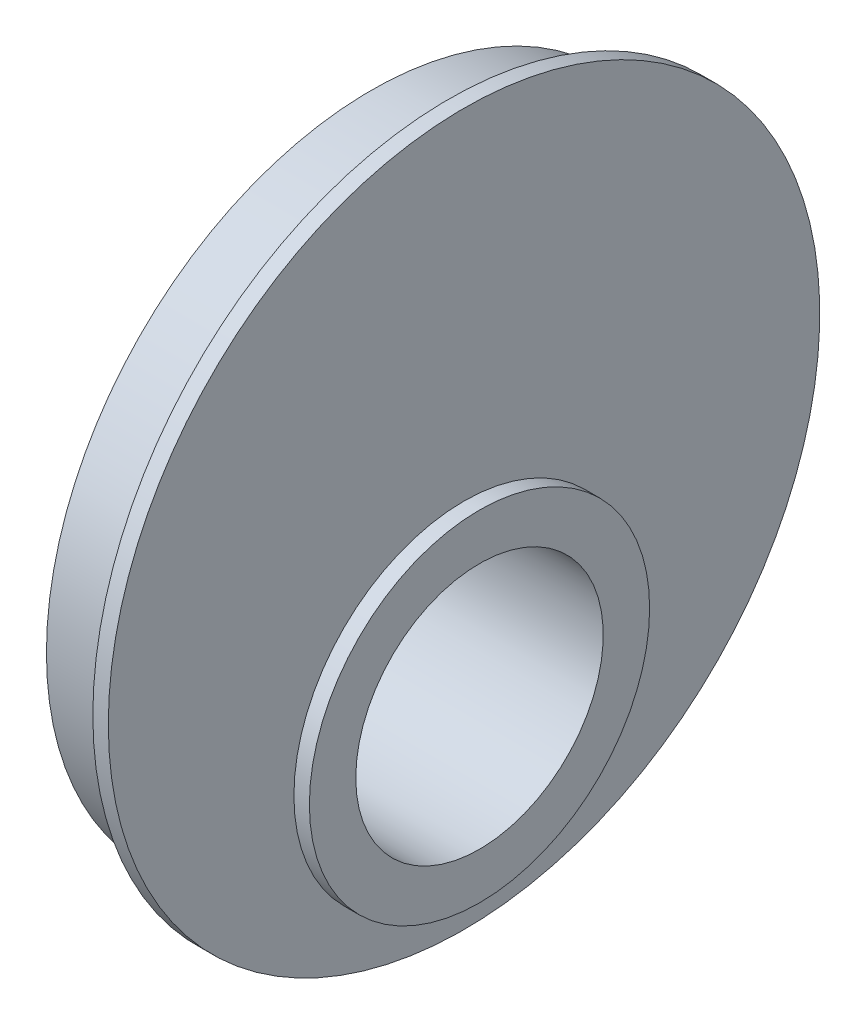
from build123d import *

# Parameters (mm, degrees)
SKETCH2_R           = 11
BOSS_EXTRUDE1_DEPTH = 1
BOSS_EXTRUDE2_START = 8
SKETCH3_R           = 11
SKETCH3_R_2         = 8
BOSS_EXTRUDE2_DEPTH = 8
SKETCH4_R           = 8
CUT_EXTRUDE1_DEPTH  = 34.496268449
SKETCH5_W           = 1.5
SKETCH5_H           = 6.215499562
CIRPATTERN1_COUNT   = 3


with BuildPart() as part:
    # Sketch1 → Revolve1 (revolve)
    with BuildSketch(Plane.XY, mode=Mode.PRIVATE) as revolve1_sk:
        Polygon((0, 0), (0, 21), (5, 21), (5, 23), (6, 23), (6, 0), align=None)
    revolve(revolve1_sk.sketch.rotate(Axis((0, 0, 0), (1, 0, 0)), 90), axis=Axis((0, 0, 0), (1, 0, 0)))

    # Sketch2 → Boss-Extrude1 (add)
    with BuildSketch(Plane(origin=(6, 0, 0), x_dir=(0, 0, -1), z_dir=(1, 0, 0))):
        with Locations((0, -10)):
            Circle(SKETCH2_R)
    extrude(amount=BOSS_EXTRUDE1_DEPTH)

    # Sketch3 → Boss-Extrude2 (add)
    with BuildSketch(Plane.ZY.offset(BOSS_EXTRUDE2_START)):
        with Locations(Location((0, -10, 0), (0, 0, 180))):
            Circle(SKETCH3_R)
        with Locations((0, -10)):
            Circle(SKETCH3_R_2, mode=Mode.SUBTRACT)
    extrude(amount=-BOSS_EXTRUDE2_DEPTH)

    # Sketch4 → Cut-Extrude1 (cut, through all)
    with BuildSketch(Plane.ZY):
        with Locations((0, -10)):
            Circle(SKETCH4_R)
    extrude(amount=-CUT_EXTRUDE1_DEPTH, mode=Mode.SUBTRACT)

    # Sketch5 → Cut-Revolve3 (revolve, cut)
    with BuildSketch(Plane.XY, mode=Mode.PRIVATE) as cut_revolve3_sk:
        with Locations((-4.75, -19.69259974)):
            Rectangle(SKETCH5_W, SKETCH5_H)
    cut_revolve3 = revolve(cut_revolve3_sk.sketch.rotate(Axis((-4, -21, 0), (0, 1, 0)), 270), axis=Axis((-4, -21, 0), (0, 1, 0)), mode=Mode.SUBTRACT)

    # CirPattern1: Cut-Revolve3 ×3 about axis
    cirpattern1_axis = Axis((-8, -10, 0), (1, 0, 0))
    for i in range(1, CIRPATTERN1_COUNT):
        add(cut_revolve3.rotate(cirpattern1_axis, i * 360 / CIRPATTERN1_COUNT), mode=Mode.SUBTRACT)


solid = part.part
